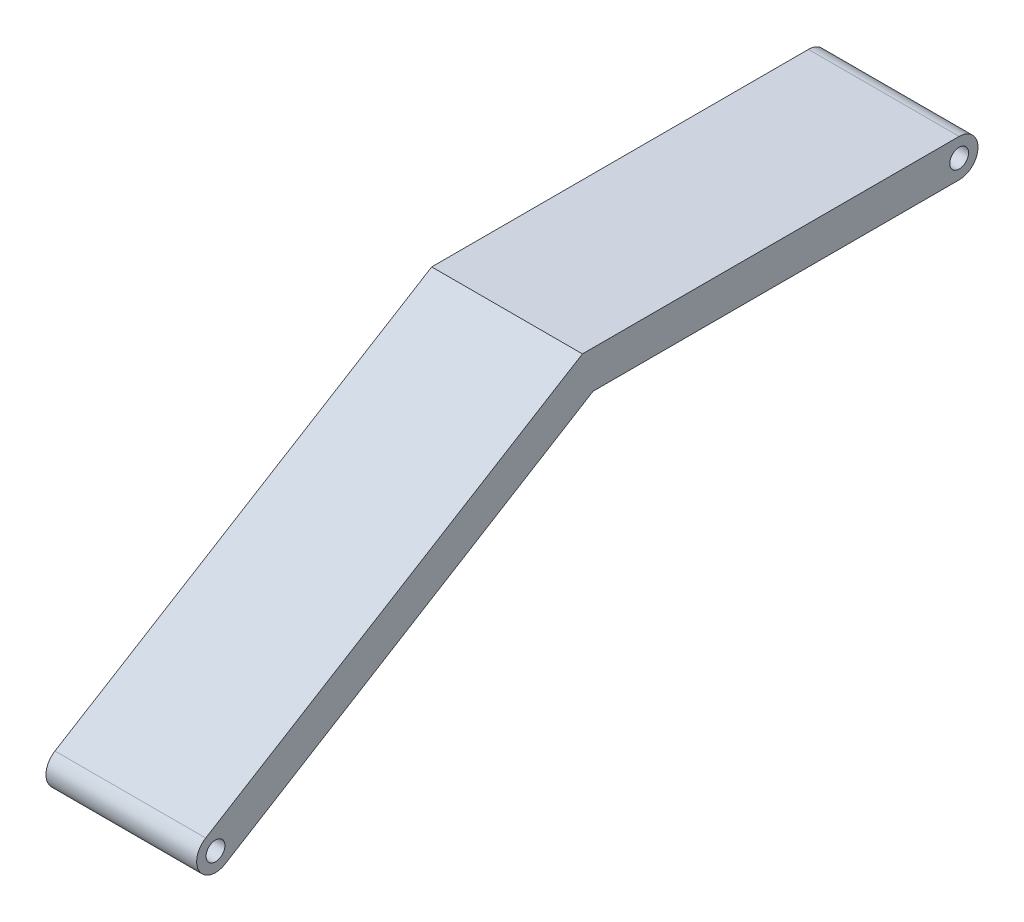
from build123d import *

# Parameters (mm, degrees)
EXTRUDE_2_DEPTH     = 4
EXTRUDE_3_DEPTH     = 4
SKETCH_3_R          = 0.25
CUT_EXTRUDE_1_DEPTH = 4


with BuildPart() as part:
    # 草图1 → 凸台-拉伸2 (new body)
    with BuildSketch(Plane(origin=(0, 0, 0), x_dir=(0, 0, -1), z_dir=(1, 0, 0))):
        Polygon((-4.326044833, 1.768613288), (5.673955167, 1.768613288), (5.673955167, 0.768613288), (-4.04400015, 0.768613288), (-13.803521761, -5.212415113), (-14.326044833, -4.359789967), align=None)
    extrude(amount=EXTRUDE_2_DEPTH)

    # 草图2 → 凸台-拉伸3 (add)
    with BuildSketch(Plane(origin=(4, 0, 0), x_dir=(0, 0, -1), z_dir=(1, 0, 0))):
        with BuildLine():
            Line((5.673955167, 0.768613288), (5.673955167, 1.768613288))
            ThreePointArc((5.673955167, 1.768613288), (6.173955167, 1.268613288), (5.673955167, 0.768613288))
        make_face()
        with BuildLine():
            Line((-14.326044833, -4.359789967), (-13.803521761, -5.212415113))
            ThreePointArc((-13.803521761, -5.212415113), (-14.49109587, -5.047364076), (-14.326044833, -4.359789967))
        make_face()
    extrude(amount=-EXTRUDE_3_DEPTH)

    # 草图3 → 切除-拉伸1 (cut)
    with BuildSketch(Plane(origin=(4, 0, 0), x_dir=(0, 0, -1), z_dir=(1, 0, 0))):
        with Locations((-14.064783297, -4.78610254)):
            Circle(SKETCH_3_R)
        with Locations((5.673955167, 1.268613288)):
            Circle(SKETCH_3_R)
    extrude(amount=-CUT_EXTRUDE_1_DEPTH, mode=Mode.SUBTRACT)


solid = part.part
